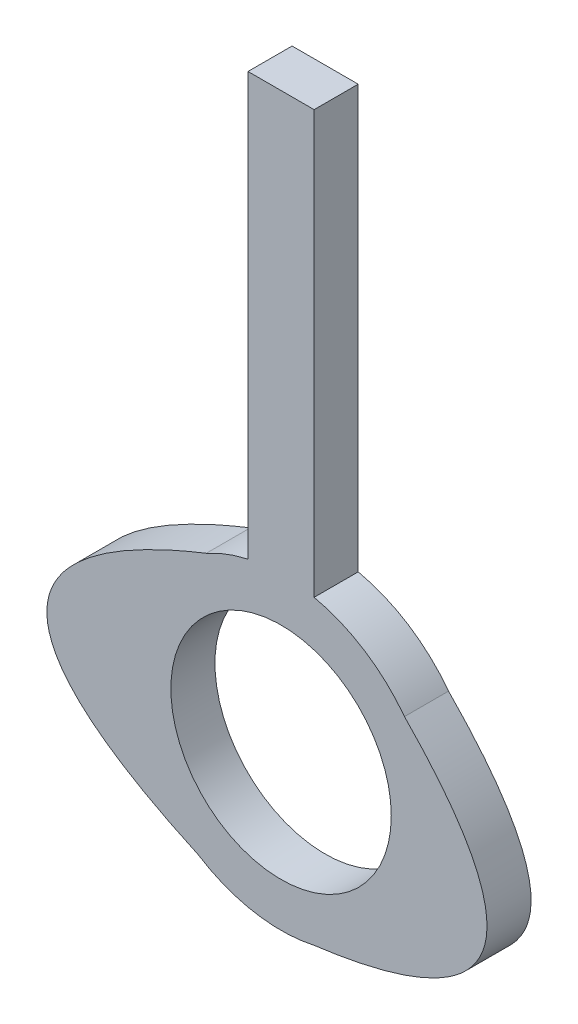
from build123d import *

# Parameters (mm, degrees)
SKETCH1_R           = 5
BOSS_EXTRUDE1_DEPTH = 2
BOSS_EXTRUDE2_DEPTH = 2


with BuildPart() as part:
    # Sketch1 → Boss-Extrude1 (new body)
    with BuildSketch(Plane.XY):
        with BuildLine():
            Line((-1.5, 6.837397166), (-1.5, 26))
            Line((-1.5, 26), (1.5, 26))
            Line((1.5, 26), (1.5, 6.837397166))
            ThreePointArc((1.5, 6.837397166), (0, -7), (-1.5, 6.837397166))
        make_face()
        Circle(SKETCH1_R, mode=Mode.SUBTRACT)
    extrude(amount=BOSS_EXTRUDE1_DEPTH)

    # Sketch2 → Boss-Extrude2 (add)
    with BuildSketch(Plane(origin=(0, 0, 0), x_dir=(-1, 0, 0), z_dir=(0, 0, -1))):
        with BuildLine():
            add(Edge.make_bspline(
                [(-5.599278763, 4.200961478), (-15.258011941, -5.628125959), (0, -7)],
                knots=[0, 0, 0, 1, 1, 1], degree=2))
            add(Edge.make_bspline(
                [(-5.599278763, 4.200961478), (-7.981604162, -4.535813919), (0, -7)],
                knots=[0, 0, 0, 1, 1, 1], degree=2))
        make_face()
        with BuildLine():
            add(Edge.make_bspline(
                [(3.393610887, 6.122369243), (18.668225354, 0.049737096), (1.677508496, -6.796025695)],
                knots=[0, 0, 0, 1, 1, 1], degree=2))
            add(Edge.make_bspline(
                [(3.393610887, 6.122369243), (10.124192035, -1.414312589), (1.677508496, -6.796025695)],
                knots=[0, 0, 0, 1, 1, 1], degree=2))
        make_face()
    extrude(amount=-BOSS_EXTRUDE2_DEPTH)


solid = part.part
